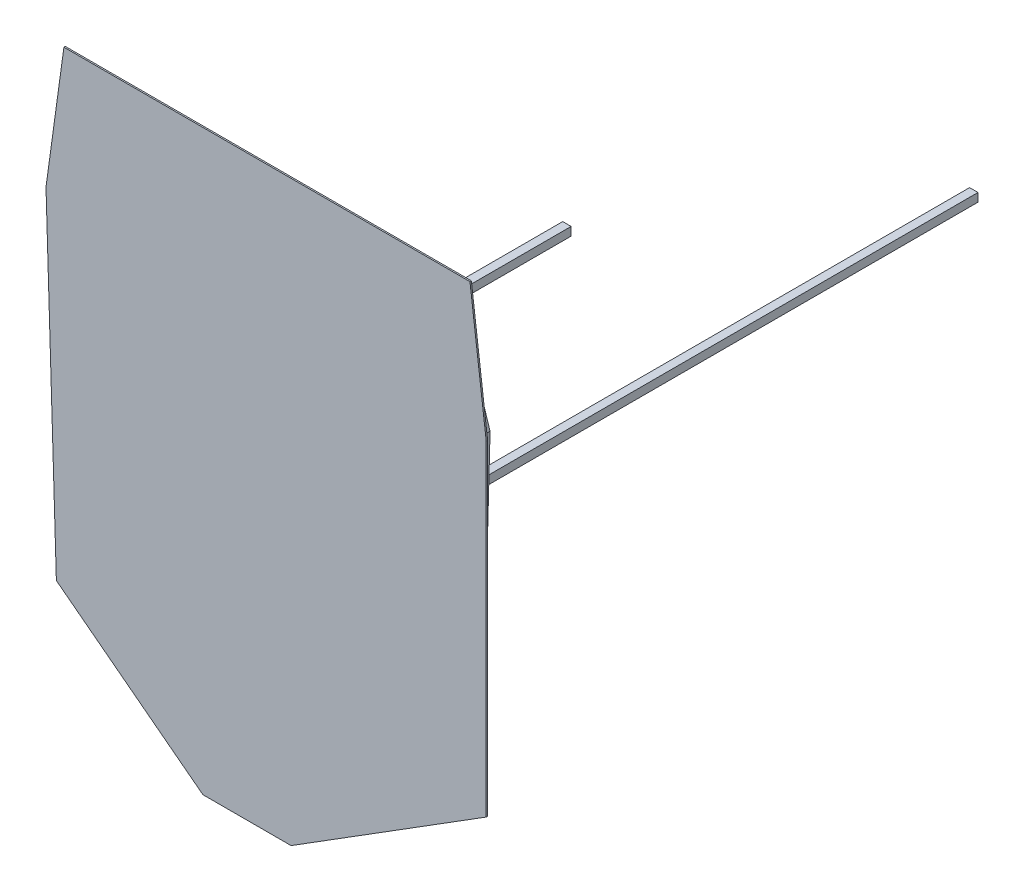
from build123d import *

# Parameters (mm, degrees)
ESQUISSE1_W        = 50
ESQUISSE1_H        = 50
BOSS_EXTRU_1_DEPTH = 5
BOSS_EXTRU_2_DEPTH = 5
ESQUISSE3_W        = 6
ESQUISSE3_H        = 6
BOSS_EXTRU_3_DEPTH = 350
BOSS_EXTRU_4_DEPTH = 1


with BuildPart() as part:
    # Esquisse1 → Boss.-Extru.1 (new body)
    with BuildSketch(Plane.XY):
        with Locations((25, 25)):
            Rectangle(ESQUISSE1_W, ESQUISSE1_H)
    extrude(amount=BOSS_EXTRU_1_DEPTH)

    # Esquisse2 → Boss.-Extru.2 (add)
    with BuildSketch(Plane.XY.offset(5)):
        Polygon((-17.13807747, 66.750016637), (11.246380261, 134.000915956), (274.564409595, 134.000915956), (292.219085418, 78.963245992), (285.658191139, -157.093376415), (157.625700404, -238.014344585), (94.995088054, -238.014344585), (-5.374322013, -157.093376415), align=None)
    extrude(amount=-BOSS_EXTRU_2_DEPTH)

    # Esquisse3 → Boss.-Extru.3 (add)
    with BuildSketch(Plane(origin=(0, 0, 0), x_dir=(-1, 0, 0), z_dir=(0, 0, -1))):
        with Locations((3, -118.721693301)):
            Rectangle(ESQUISSE3_W, ESQUISSE3_H)
        with Locations((-287, 47.238939464)):
            Rectangle(ESQUISSE3_W, ESQUISSE3_H)
    extrude(amount=BOSS_EXTRU_3_DEPTH)

    # Esquisse4 → Boss.-Extru.4 (add)
    with BuildSketch(Plane.XY.offset(5)):
        Polygon((-5.533858716, 170.143499993), (283.889977684, 170.143499993), (295.480369275, 77.420367263), (295.480369275, -154.566750541), (156.395670181, -241.735343219), (93.529944497, -241.735343219), (-10.909112788, -161.778438909), (-18.300087136, 77.420367263), align=None)
    extrude(amount=BOSS_EXTRU_4_DEPTH)


solid = part.part
